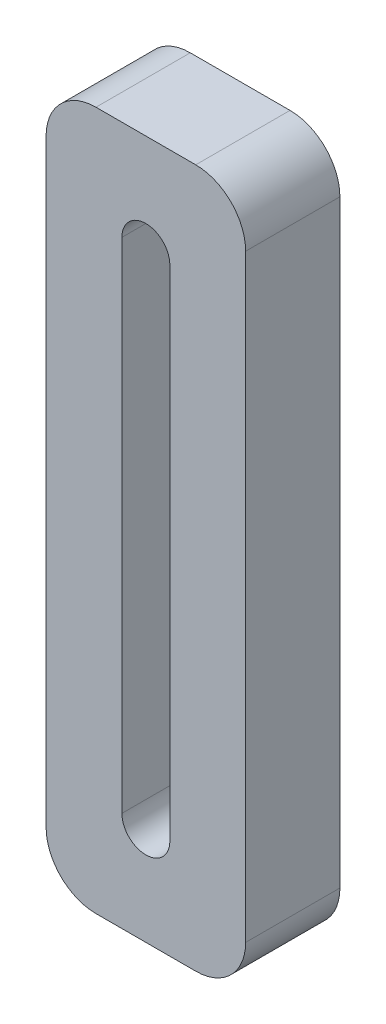
from build123d import *

# Parameters (mm, degrees)
SKETCH1_W           = 12.7
SKETCH1_H           = 44.45
BOSS_EXTRUDE1_DEPTH = 3
FILLET1_R           = 3.175


with BuildPart() as part:
    # Sketch1 → Boss-Extrude1 (new, symmetric)
    with BuildSketch(Plane.XY):
        Rectangle(SKETCH1_W, SKETCH1_H)
        with BuildLine():
            Line((1.526908397, 15.875), (1.526908397, -15.875))
            ThreePointArc((1.526908397, -15.875), (0, -17.401908397), (-1.526908397, -15.875))
            Line((-1.526908397, -15.875), (-1.526908397, 15.875))
            ThreePointArc((-1.526908397, 15.875), (0, 17.401908397), (1.526908397, 15.875))
        make_face(mode=Mode.SUBTRACT)
    extrude(amount=BOSS_EXTRUDE1_DEPTH, both=True)

    # Fillet1
    fillet1_edges = [part.edges().sort_by_distance(p)[0] for p in [
        (6.35, -22.225, 0),
        (-6.35, -22.225, 0),
        (-6.35, 22.225, 0),
        (6.35, 22.225, 0),
    ]]
    fillet(fillet1_edges, radius=FILLET1_R)


solid = part.part
